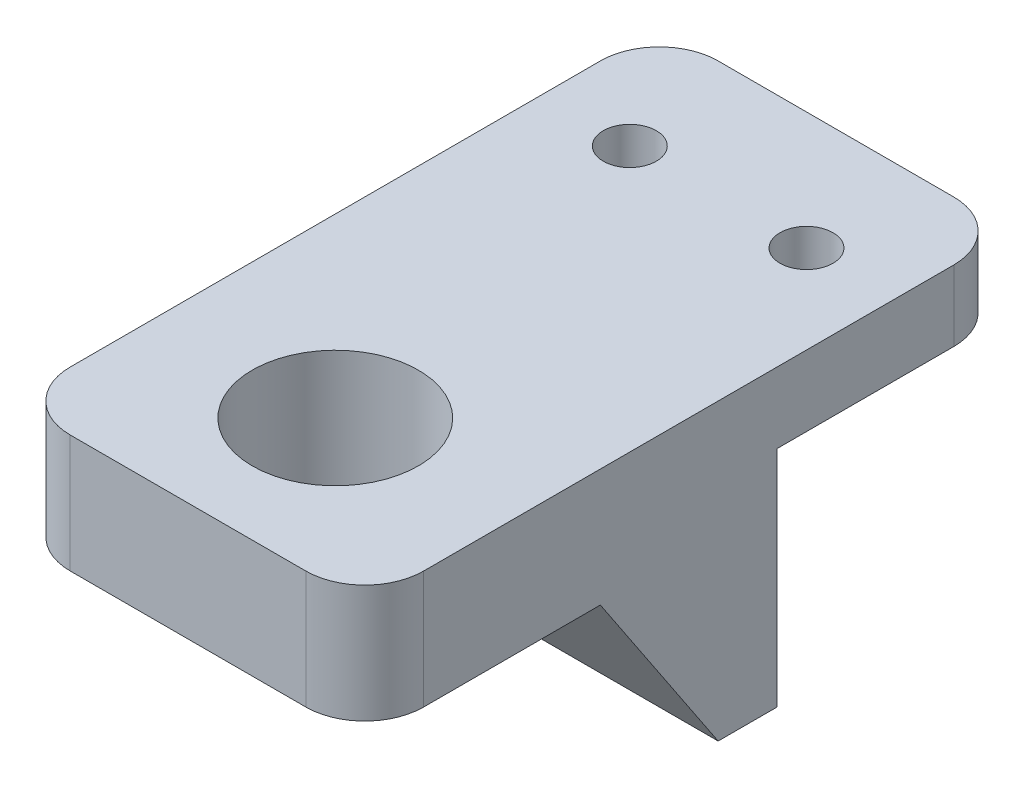
from build123d import *

# Parameters (mm, degrees)
SKETCH1_W               = 30
SKETCH1_H               = 55
SKETCH1_R               = 2.25
BOSS_EXTRUDE1_DEPTH     = 6
SKETCH3_W               = 30
SKETCH3_H               = 35
BOSS_EXTRUDE2_DEPTH     = 4
BOSS_EXTRUDE3_DEPTH     = 30
CUT_EXTRUDE1_DEPTH      = 52.53882032
CUT_EXTRUDE1_DEPTH_BACK = 52.53882032
SKETCH2_R               = 7.05
FILLET1_R               = 5


with BuildPart() as part:
    # Sketch1 → Boss-Extrude1 (new body)
    with BuildSketch(Plane(origin=(0, 0, 0), x_dir=(1, 0, 0), z_dir=(0, 1, 0))):
        with Locations((0, 15)):
            Rectangle(SKETCH1_W, SKETCH1_H)
        with Locations(Location((-7.5, 32.5, 0), (0, 0, 270))):
            Circle(SKETCH1_R, mode=Mode.SUBTRACT)
        with Locations(Location((7.5, 32.5, 0), (0, 0, 90))):
            Circle(SKETCH1_R, mode=Mode.SUBTRACT)
    extrude(amount=BOSS_EXTRUDE1_DEPTH)

    # Sketch3 → Boss-Extrude2 (add)
    with BuildSketch(Plane.XZ):
        with Locations((0, -5)):
            Rectangle(SKETCH3_W, SKETCH3_H)
    extrude(amount=BOSS_EXTRUDE2_DEPTH)

    # Sketch4 → Boss-Extrude3 (add)
    with BuildSketch(Plane.ZY.offset(15)):
        Polygon((-22.5, -4), (-22.5, -19), (-17.5, -19), (-7.5, -4), align=None)
    extrude(amount=-BOSS_EXTRUDE3_DEPTH)

    # Sketch2 → Cut-Extrude1 (cut, two sides: drawn at the far end of the back side and taken through both)
    with BuildSketch(Plane(origin=(0, 6, 0), x_dir=(1, 0, 0), z_dir=(0, 1, 0)).offset(-CUT_EXTRUDE1_DEPTH_BACK)):
        with Locations(Location((0, 0, 0), (0, 0, 270))):
            Circle(SKETCH2_R)
    extrude(amount=CUT_EXTRUDE1_DEPTH + CUT_EXTRUDE1_DEPTH_BACK, mode=Mode.SUBTRACT)

    # Fillet1
    fillet1_edges = [part.edges().sort_by_distance(p)[0] for p in [
        (-15, 3, -42.5),
        (15, 3, -42.5),
        (15, 1, 12.5),
        (-15, 1, 12.5),
    ]]
    fillet(fillet1_edges, radius=FILLET1_R)


solid = part.part
